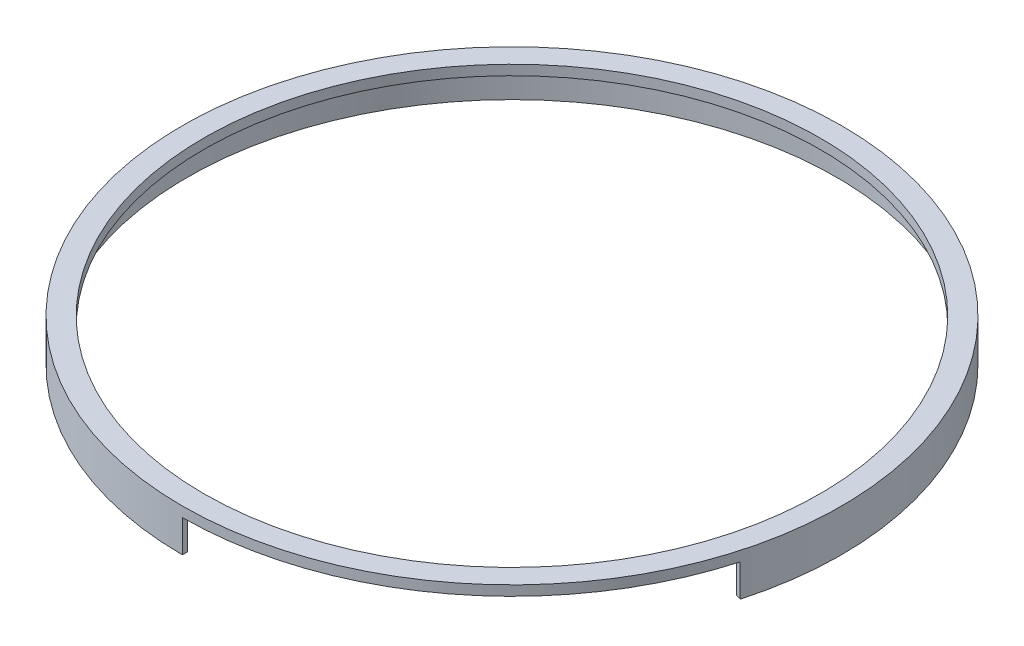
from build123d import *
from build123d.topology import SkipClean

# Parameters (mm, degrees)
SKETCH2_R           = 66.3
SKETCH2_R_2         = 62
BOSS_EXTRUDE1_DEPTH = 2
BOSS_EXTRUDE2_START = 6.5
BOSS_EXTRUDE2_DEPTH = 6.5


with BuildPart() as part:
    # Sketch2 → Boss-Extrude1 (new body)
    with BuildSketch(Plane(origin=(0, 0, 0), x_dir=(1, 0, 0), z_dir=(0, 1, 0))):
        with Locations(Location((0, 0, 0), (0, 0, 270))):
            Circle(SKETCH2_R)
        with Locations(Location((0, 0, 0), (0, 0, 270))):
            Circle(SKETCH2_R_2, mode=Mode.SUBTRACT)
    extrude(amount=BOSS_EXTRUDE1_DEPTH)

    # Sketch3 → Boss-Extrude2 (add)
    with SkipClean():  # the faces are left unmerged after this step: merging them gives an invalid solid
        with BuildSketch(Plane.XZ.offset(BOSS_EXTRUDE2_START)):
            with BuildLine():
                ThreePointArc((65.3, 0), (-46.174072811, -46.174072811), (0, 65.3))
                Line((0, 65.3), (0, 66.3))
                ThreePointArc((0, 66.3), (-46.881179593, -46.881179593), (66.3, 0))
                ThreePointArc((66.3, 0), (65.680309111, 9.043616265), (63.832820659, 17.918175317))
                Line((63.832820659, 17.918175317), (62.870033017, 17.647916262))
                ThreePointArc((62.870033017, 17.647916262), (64.689655881, 8.907211796), (65.3, 0))
            make_face()
        extrude(amount=-BOSS_EXTRUDE2_DEPTH)


solid = part.part
